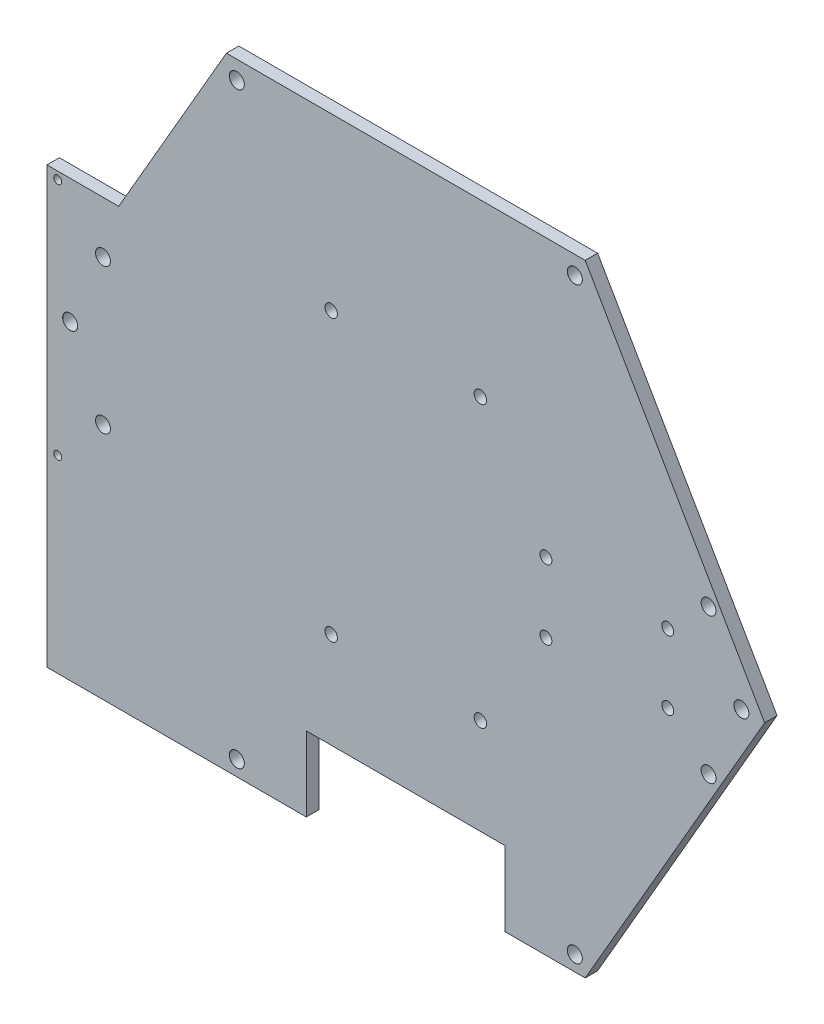
from build123d import *

# Parameters (mm, degrees)
EXTRUDE_3_DEPTH                 = 5
HOLE_WIZARD_6_0_6_1_D           = 6
HOLE_WIZARD_6_0_6_1_CSINK_D     = 6.05
HOLE_WIZARD_6_0_6_1_CSINK_ANGLE = 90
SKETCH_20_R                     = 2.4
CUT_EXTRUDE_2_DEPTH             = 192.006108105
SKETCH_33_R                     = 3
CUT_EXTRUDE_3_DEPTH             = 192.006108105
SKETCH_34_R                     = 2.5
CUT_EXTRUDE_4_DEPTH             = 192.006108105
SKETCH_35_R                     = 1.6
EXTRUDE_5_DEPTH                 = 5


with BuildPart() as part:
    # 草图8 → 凸台-拉伸3 (new body)
    with BuildSketch(Plane.XY):
        Polygon((144.337567297, 0), (72.168783649, 125), (-72.168783649, 125), (-144.337567297, 0), (-72.168783649, -125), (-40, -125), (-40, -95), (40, -95), (40, -125), (72.168783649, -125), align=None)
    extrude(amount=EXTRUDE_3_DEPTH)

    # Ø6.0 (6) 直径孔1 (through all)
    with Locations(Plane.XY.offset(5)):
        with Locations((-135.003092598, 0), (-67.980688817, -118.866778441), (-67.980688817, 117.662022204)):
            hole_wizard_6_0_6_1 = CounterSinkHole(HOLE_WIZARD_6_0_6_1_D / 2, HOLE_WIZARD_6_0_6_1_CSINK_D / 2, counter_sink_angle=HOLE_WIZARD_6_0_6_1_CSINK_ANGLE)

    # 镜向2: Ø6.0 (6) 直径孔1 across plane
    add(hole_wizard_6_0_6_1.mirror(Plane(origin=(0, 0, 0), x_dir=(0, 0, 1), z_dir=(1, 0, 0))), mode=Mode.SUBTRACT)

    # 草图20 → 切除-拉伸2 (cut, through all)
    with BuildSketch(Plane.XY.offset(5)):
        with Locations((56.370867728, 13.653021969)):
            Circle(SKETCH_20_R)
        with Locations((105.370867728, 13.324633606)):
            Circle(SKETCH_20_R)
        with Locations((56.370867728, -14.346978031)):
            Circle(SKETCH_20_R)
        with Locations((105.370867728, -14.346978031)):
            Circle(SKETCH_20_R)
    extrude(amount=-CUT_EXTRUDE_2_DEPTH, mode=Mode.SUBTRACT)

    # 草图33 → 切除-拉伸3 (cut, through all)
    with BuildSketch(Plane.XY.offset(5)):
        with Locations((-121.797773, -29.181235)):
            Circle(SKETCH_33_R)
        with Locations(Location((121.797773, -29.181235, 0), (0, 0, 180))):
            Circle(SKETCH_33_R)
        with Locations((121.797773, 29.181235)):
            Circle(SKETCH_33_R)
        with Locations(Location((-121.797773, 29.181235, 0), (0, 0, 180))):
            Circle(SKETCH_33_R)
    extrude(amount=-CUT_EXTRUDE_3_DEPTH, mode=Mode.SUBTRACT)

    # 草图34 → 切除-拉伸4 (cut, through all)
    with BuildSketch(Plane.XY.offset(5)):
        with Locations((-30, -56.392396)):
            Circle(SKETCH_34_R)
        with Locations(Location((30, -56.392396, 0), (0, 0, 180))):
            Circle(SKETCH_34_R)
        with Locations((30, 56.392396)):
            Circle(SKETCH_34_R)
        with Locations(Location((-30, 56.392396, 0), (0, 0, 180))):
            Circle(SKETCH_34_R)
    extrude(amount=-CUT_EXTRUDE_4_DEPTH, mode=Mode.SUBTRACT)

    # 草图35 → 凸台-拉伸5 (add)
    # profile 1 of 2: a face of its own
    with BuildSketch(Plane.XY):
        Polygon((-144.337567297, 0), (-115.470053838, 50), (-144.337567297, 50), align=None)
        with Locations((-140, 47)):
            Circle(SKETCH_35_R, mode=Mode.SUBTRACT)
    # profile 2 of 2: a face of its own
    with BuildSketch(Plane.XY):
        Polygon((-72.168783649, -125), (-144.337567297, 0), (-144.337567297, -125), align=None)
        with Locations((-140, -49)):
            Circle(SKETCH_35_R, mode=Mode.SUBTRACT)
    extrude(amount=EXTRUDE_5_DEPTH)


solid = part.part
